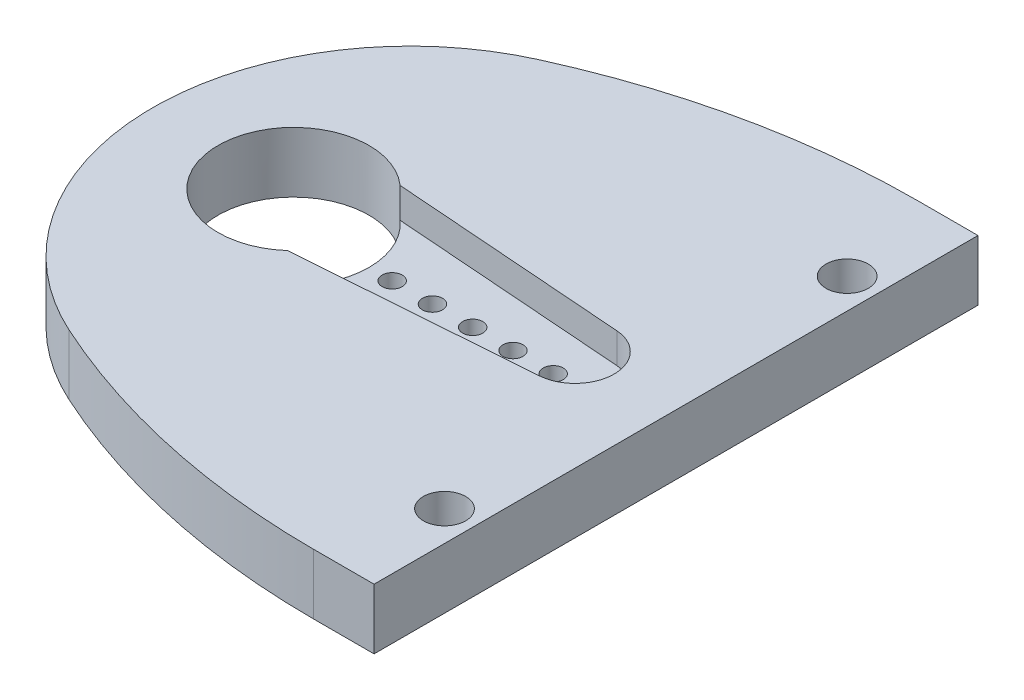
from build123d import *

# Parameters (mm, degrees)
SKETCH1_R               = 1.05
SKETCH1_R_2             = 2.35
BOSS_EXTRUDE1_DEPTH     = 3
ENL_V_MAT_EXTRU_1_DEPTH = 1.5
ESQUISSE3_R             = 0.5
ESQUISSE3_R_2           = 3.75
ENL_V_MAT_EXTRU_7_DEPTH = 25.253865818


with BuildPart() as part:
    # Sketch1 → Boss-Extrude1 (new body)
    with BuildSketch(Plane(origin=(0, 0, 0), x_dir=(1, 0, 0), z_dir=(0, 1, 0))):
        with BuildLine():
            Line((19, 15), (16, 15))
            ThreePointArc((16, 15), (8.07047508, 14.15151711), (0.5, 11.644487847))
            ThreePointArc((0.5, 11.644487847), (-7, 0), (0.5, -11.644487847))
            ThreePointArc((0.5, -11.644487847), (8.07047508, -14.15151711), (16, -15))
            Line((16, -15), (19, -15))
            Line((19, -15), (19, 15))
        make_face()
        with Locations(Location((17.5, -10, 0), (0, 0, 270))):
            Circle(SKETCH1_R, mode=Mode.SUBTRACT)
        with Locations(Location((17.5, 10, 0), (0, 0, 270))):
            Circle(SKETCH1_R, mode=Mode.SUBTRACT)
        with Locations(Location((0, 0, 0), (0, 0, 270))):
            Circle(SKETCH1_R_2, mode=Mode.SUBTRACT)
    extrude(amount=-BOSS_EXTRUDE1_DEPTH)

    # Esquisse1 → Enlèv. mat.-Extru.1 (cut)
    with BuildSketch(Plane(origin=(0, 0, 0), x_dir=(1, 0, 0), z_dir=(0, 1, 0))):
        with BuildLine():
            Line((2.494493937, -2.8), (14.131406802, -1.932309126))
            add(Edge.make_bspline(
                [(14.131406802, -1.932309126), (14.497286128, -1.904835216), (14.827491954, -1.746052706), (15.157338026, -1.587443187), (15.407154881, -1.318584734), (15.656200737, -1.050556048), (15.790562016, -0.709168668), (15.92490372, -0.367831024), (15.925, 0), (15.925095847, 0.366175279), (15.791018176, 0.708007672), (15.657374187, 1.048734388), (15.407835717, 1.317851242), (15.159067388, 1.586137532), (14.828615817, 1.74551148), (14.498449498, 1.904747853), (14.131406802, 1.932309126)],
                knots=[0, 0, 0, 0.125, 0.125, 0.25, 0.25, 0.375, 0.375, 0.5, 0.5, 0.625, 0.625, 0.75, 0.75, 0.875, 0.875, 1, 1, 1], degree=2))
            Line((14.131406802, 1.932309126), (2.494493937, 2.8))
            ThreePointArc((2.494493937, 2.8), (-3.75, 0), (2.494493937, -2.8))
        make_face()
    extrude(amount=-ENL_V_MAT_EXTRU_1_DEPTH, mode=Mode.SUBTRACT)

    # Esquisse3 → Enlèv. mat.-Extru.7 (cut, through all)
    with BuildSketch(Plane(origin=(0, -1.5, 0), x_dir=(1, 0, 0), z_dir=(0, 1, 0))):
        with Locations(Location((4.9, 0, 0), (0, 0, 270))):
            Circle(ESQUISSE3_R)
        with Locations(Location((6.9, 0, 0), (0, 0, 270))):
            Circle(ESQUISSE3_R)
        with Locations(Location((8.9, 0, 0), (0, 0, 270))):
            Circle(ESQUISSE3_R)
        with Locations(Location((10.9, 0, 0), (0, 0, 270))):
            Circle(ESQUISSE3_R)
        with Locations(Location((12.9, 0, 0), (0, 0, 270))):
            Circle(ESQUISSE3_R)
        with Locations(Location((0, 0, 0), (0, 0, 270))):
            Circle(ESQUISSE3_R_2)
    extrude(amount=-ENL_V_MAT_EXTRU_7_DEPTH, mode=Mode.SUBTRACT)


solid = part.part
